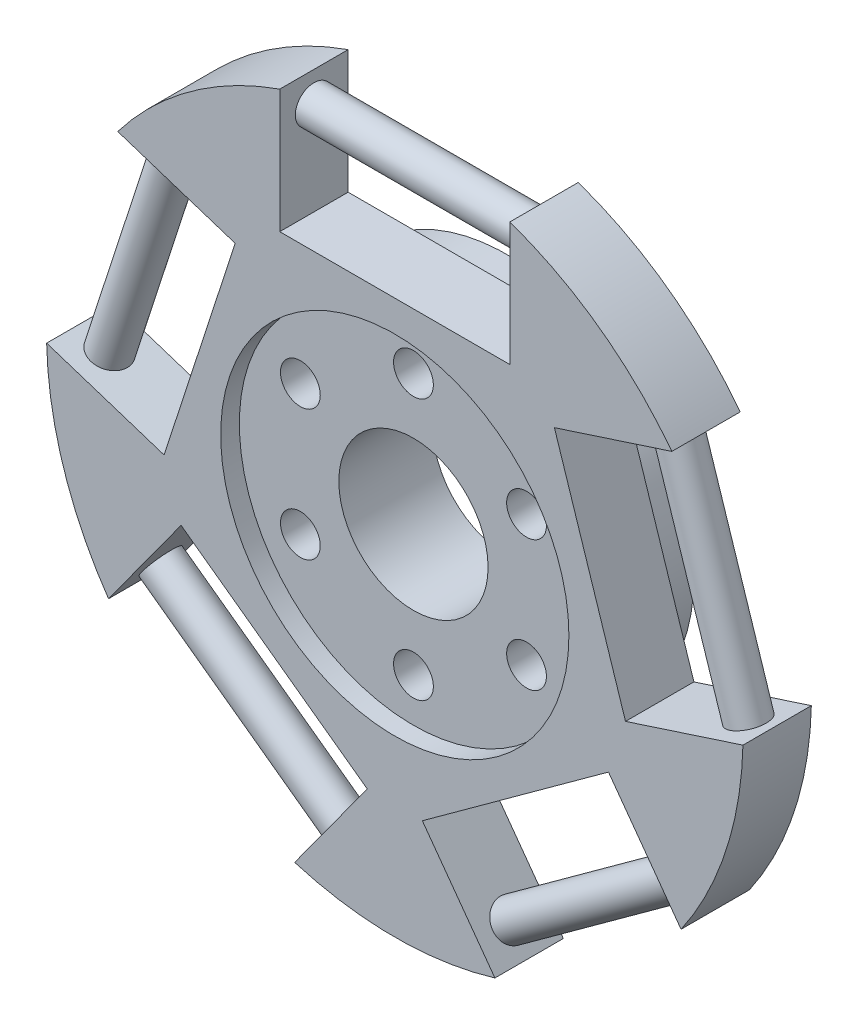
from build123d import *
from build123d.topology import SkipClean

# Parameters (mm, degrees)
SKETCH_1_R               = 28
SKETCH_1_R_2             = 6
EXTRUDE_1_DEPTH          = 5.5
SKETCH_2_W               = 18.5
SKETCH_2_H               = 13.5
CUT_EXTRUDE_1_DEPTH      = 6
SKETCH_3_R               = 1.5
EXTRUDE_2_DEPTH          = 18.5
PATTERN_CIRCULAR_1_COUNT = 5
EXTRUDE_START            = 3.55
SKETCH_4_R               = 15
SKETCH_4_R_2             = 6
EXTRUDE_3_DEPTH          = 3.55
SKETCH_10_R              = 14
CUT_EXTRUDE_5_DEPTH      = 1.5
SKETCH_11_R              = 1.6
CUT_EXTRUDE_6_DEPTH      = 10
PATTERN_CIRCULAR_2_COUNT = 6


with BuildPart() as part:
    # 草图1 → 凸台-拉伸1 (new body)
    with BuildSketch(Plane.XY):
        Circle(SKETCH_1_R)
        Circle(SKETCH_1_R_2, mode=Mode.SUBTRACT)
    extrude(amount=EXTRUDE_1_DEPTH)

    # 草图2 → 切除-拉伸1 (cut)
    with BuildSketch(Plane.XY.offset(5.5)):
        with Locations((0, 23.25)):
            Rectangle(SKETCH_2_W, SKETCH_2_H)
    cut_extrude_1 = extrude(amount=-CUT_EXTRUDE_1_DEPTH, mode=Mode.SUBTRACT)

    # 草图3 → 凸台-拉伸2 (add)
    with BuildSketch(Plane(origin=(-9.25, 0, 0), x_dir=(0, 0, -1), z_dir=(1, 0, 0))):
        with Locations(Location((-2.75, 24, 0), (0, 0, 180))):
            Circle(SKETCH_3_R)
    extrude_2 = extrude(amount=EXTRUDE_2_DEPTH)

    # 阵列(圆周)1: 切除-拉伸1, 凸台-拉伸2 ×5 about axis
    pattern_circular_1_axis = Axis((0, 0, 0), (0, 0, 1))
    add([cut_extrude_1.rotate(pattern_circular_1_axis, i * 360 / PATTERN_CIRCULAR_1_COUNT) for i in range(1, PATTERN_CIRCULAR_1_COUNT)], mode=Mode.SUBTRACT)
    add([extrude_2.rotate(pattern_circular_1_axis, i * 360 / PATTERN_CIRCULAR_1_COUNT) for i in range(1, PATTERN_CIRCULAR_1_COUNT)])

    # 草图4 → 凸台-拉伸3 (add)
    with SkipClean():  # the faces are left unmerged after this step: merging them gives an invalid solid
        with BuildSketch(Plane(origin=(0, 0, 0), x_dir=(-1, 0, 0), z_dir=(0, 0, -1)).offset(EXTRUDE_START)):
            with Locations(Location((0, 0, 0), (0, 0, 180))):
                Circle(SKETCH_4_R)
            Circle(SKETCH_4_R_2, mode=Mode.SUBTRACT)
        extrude(amount=-EXTRUDE_3_DEPTH)

    # 草图10 → 切除-拉伸5 (cut)
    with BuildSketch(Plane.XY.offset(5.5)):
        Circle(SKETCH_10_R)
    extrude(amount=-CUT_EXTRUDE_5_DEPTH, mode=Mode.SUBTRACT)

    # 草图11 → 切除-拉伸6 (cut)
    with BuildSketch(Plane.XY.offset(4)):
        with Locations((0, -10.5)):
            Circle(SKETCH_11_R)
    cut_extrude_6 = extrude(amount=-CUT_EXTRUDE_6_DEPTH, mode=Mode.SUBTRACT)

    # 阵列(圆周)2: 切除-拉伸6 ×6 about axis
    pattern_circular_2_axis = Axis((0, 0, 0), (0, 0, 1))
    for i in range(1, PATTERN_CIRCULAR_2_COUNT):
        add(cut_extrude_6.rotate(pattern_circular_2_axis, i * 360 / PATTERN_CIRCULAR_2_COUNT), mode=Mode.SUBTRACT)


solid = part.part
